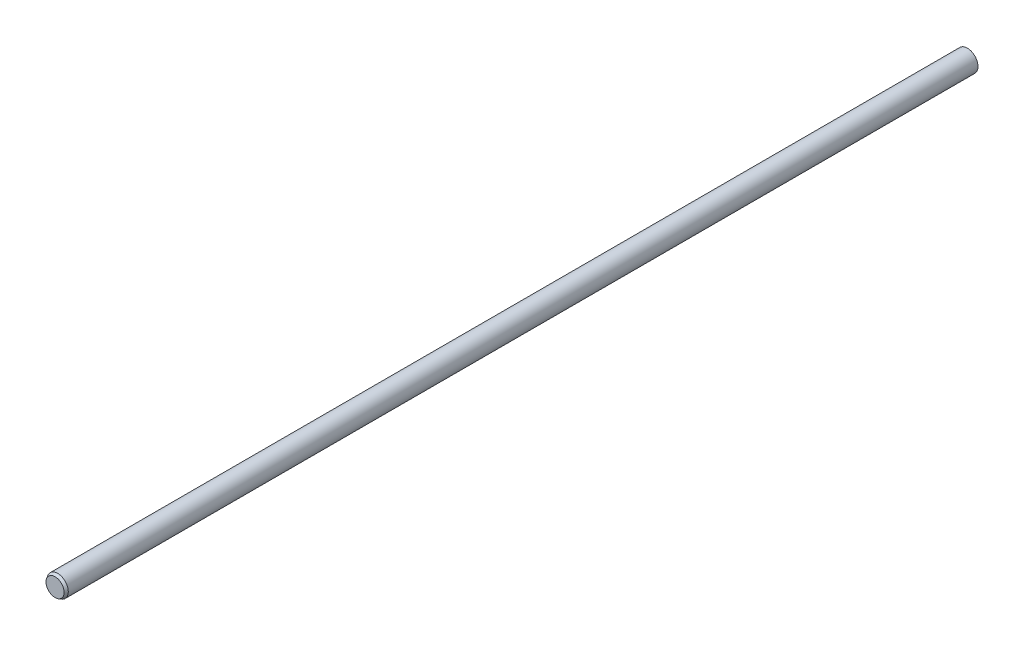
from build123d import *
from OCP.BRepFilletAPI import BRepFilletAPI_MakeChamfer

# Parameters (mm, degrees)
SKETCH1_R           = 4
BOSS_EXTRUDE1_DEPTH = 345
CHAMFER1_SIZE       = 1
CHAMFER1_SIZE2      = 0.577350269


with BuildPart() as part:
    # Sketch1 → Boss-Extrude1 (new body)
    with BuildSketch(Plane.XY):
        Circle(SKETCH1_R)
    extrude(amount=BOSS_EXTRUDE1_DEPTH)

    # Chamfer1: one chamfer whose edges measure the first distance from different faces: ONE call of the kernel's chamfer builder (chamfer() names one face for all edges)
    chamfer1_edges_1 = [part.edges().sort_by_distance(p)[0] for p in [
        (-4, 0, 0),
    ]]
    chamfer1_side_1 = [part.faces().sort_by_distance(p)[0] for p in [
        (0, 0, 0),
    ]]
    chamfer1_edges_2 = [part.edges().sort_by_distance(p)[0] for p in [
        (-4, 0, 345),
    ]]
    chamfer1_side_2 = [part.faces().sort_by_distance(p)[0] for p in [
        (-4, 0, 172.5),
    ]]
    chamfer1 = BRepFilletAPI_MakeChamfer(part.part.solid().wrapped)
    for e in chamfer1_edges_1:
        chamfer1.Add(CHAMFER1_SIZE, CHAMFER1_SIZE2, e.wrapped, chamfer1_side_1[0].wrapped)  # the first distance lies on this face
    for e in chamfer1_edges_2:
        chamfer1.Add(CHAMFER1_SIZE, CHAMFER1_SIZE2, e.wrapped, chamfer1_side_2[0].wrapped)  # the first distance lies on this face
    add(Compound.cast(chamfer1.Shape()), mode=Mode.REPLACE)


solid = part.part
